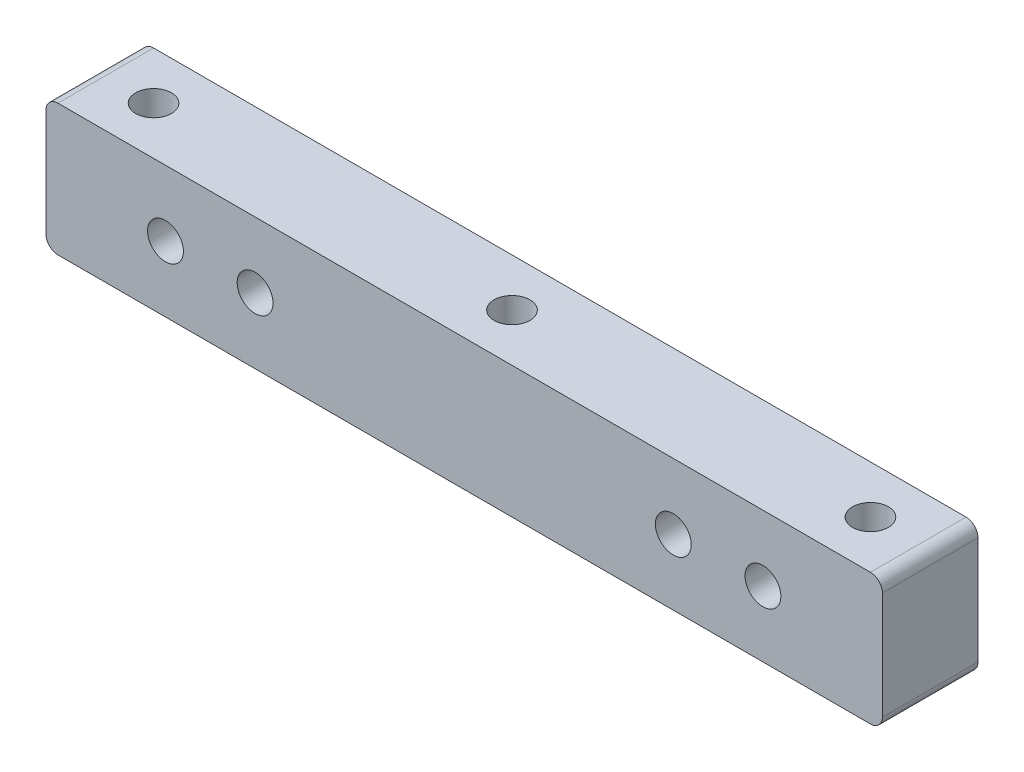
from build123d import *

# Parameters (mm, degrees)
SKETCH1_W           = 140
SKETCH1_H           = 22
BOSS_EXTRUDE1_DEPTH = 16
SKETCH2_R           = 3
HOLES_DEPTH         = 15.8
SKETCH3_R           = 3
CUT_EXTRUDE2_DEPTH  = 76.099933422
FILLET2_R           = 2
FILLET4_R           = 2


with BuildPart() as part:
    # Sketch1 → Boss-Extrude1 (new body)
    with BuildSketch(Plane.XY):
        Rectangle(SKETCH1_W, SKETCH1_H)
    extrude(amount=BOSS_EXTRUDE1_DEPTH)

    # Sketch2 → holes (cut)
    with BuildSketch(Plane.XY.offset(16)):
        with Locations((35, 0)):
            Circle(SKETCH2_R)
        with Locations((50, 0)):
            Circle(SKETCH2_R)
        with Locations((-35, 0)):
            Circle(SKETCH2_R)
        with Locations((-50, 0)):
            Circle(SKETCH2_R)
    extrude(amount=-HOLES_DEPTH, mode=Mode.SUBTRACT)

    # Sketch3 → Cut-Extrude2 (cut, through all)
    with BuildSketch(Plane(origin=(0, 11, 0), x_dir=(1, 0, 0), z_dir=(0, 1, 0))):
        with Locations(Location((0, -8, 0), (0, 0, 270))):
            Circle(SKETCH3_R)
        with Locations(Location((60, -8, 0), (0, 0, 270))):
            Circle(SKETCH3_R)
        with Locations(Location((-60, -8, 0), (0, 0, 90))):
            Circle(SKETCH3_R)
    extrude(amount=-CUT_EXTRUDE2_DEPTH, mode=Mode.SUBTRACT)

    # Fillet2
    fillet2_edges = [part.edges().sort_by_distance(p)[0] for p in [
        (-70, -11, 8),
        (-70, 11, 8),
    ]]
    fillet(fillet2_edges, radius=FILLET2_R)

    # Fillet4
    fillet4_edges = [part.edges().sort_by_distance(p)[0] for p in [
        (70, -11, 8),
        (70, 11, 8),
    ]]
    fillet(fillet4_edges, radius=FILLET4_R)


solid = part.part
